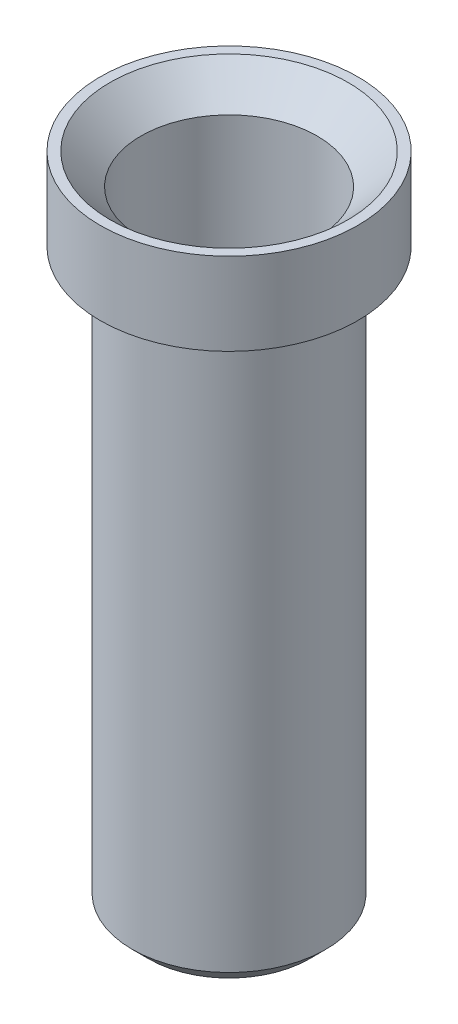
from build123d import *

# Parameters (mm, degrees)
CHAMFER_1_SIZE = 0.16


with BuildPart() as part:
    # 草图1 → 旋转1 (revolve)
    with BuildSketch(Plane.XY, mode=Mode.PRIVATE) as revolve_1_sk:
        Polygon((0, -5.6), (-0.94, -5.6), (-0.94, 0), (-1.25, 0), (-1.25, 0.8), (-1.155, 0.8), (-0.855, 0.5), (-0.855, -4.4), (0, -4.97034157), align=None)
    revolve(revolve_1_sk.sketch.rotate(Axis((0, 8.238789055, 0), (0, -1, 0)), 270), axis=Axis((0, 8.238789055, 0), (0, -1, 0)))

    # 倒角1
    chamfer_1_edges = [part.edges().sort_by_distance(p)[0] for p in [
        (0, -5.6, -0.94),
    ]]
    chamfer(chamfer_1_edges, length=CHAMFER_1_SIZE)


solid = part.part
